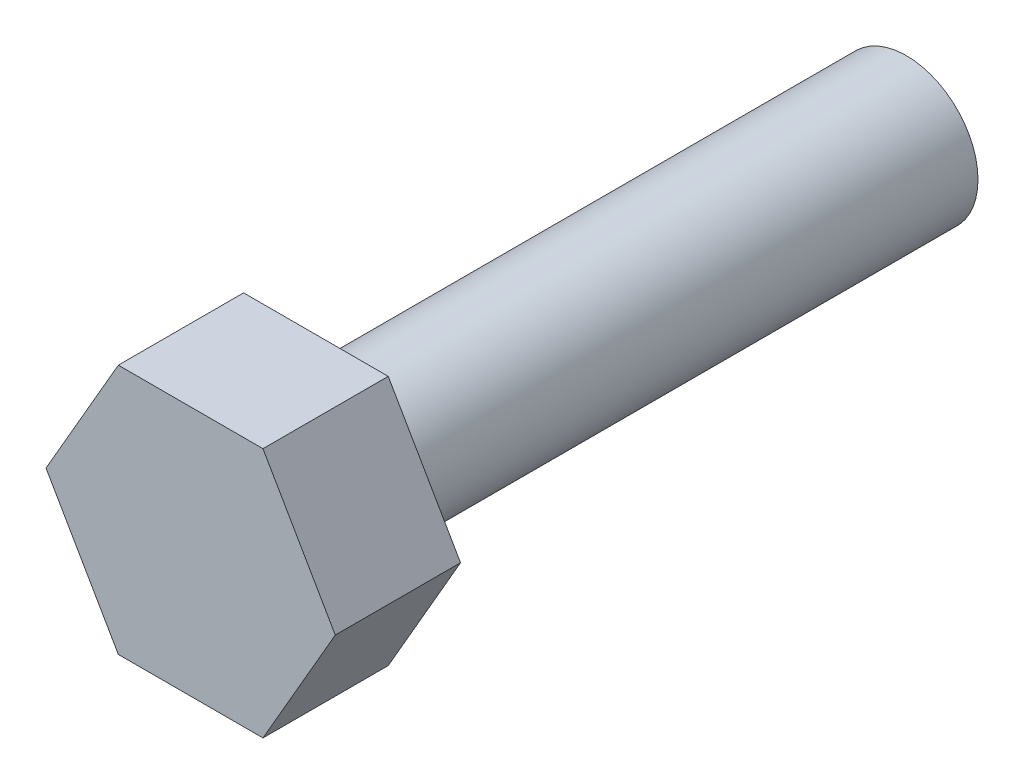
from build123d import *

# Parameters (mm, degrees)
BOSS_EXTRUDE1_DEPTH = 177.8
SKETCH2_W           = 101.6
SKETCH2_H           = 838.2


with BuildPart() as part:
    # Sketch1 → Boss-Extrude1 (new body)
    with BuildSketch(Plane.XY.offset(1016)):
        Polygon((-102.652877862, -177.8), (102.652877862, -177.8), (205.305755724, 0), (102.652877862, 177.8), (-102.652877862, 177.8), (-205.305755724, 0), align=None)
    extrude(amount=-BOSS_EXTRUDE1_DEPTH)

    # Sketch2 → Revolve1 (revolve)
    with BuildSketch(Plane(origin=(0, 0, 0), x_dir=(1, 0, 0), z_dir=(0, 1, 0))):
        with Locations((50.8, -419.1)):
            Rectangle(SKETCH2_W, SKETCH2_H)
    revolve(axis=Axis((0, 0, 0), (0, 0, 1)))


solid = part.part
